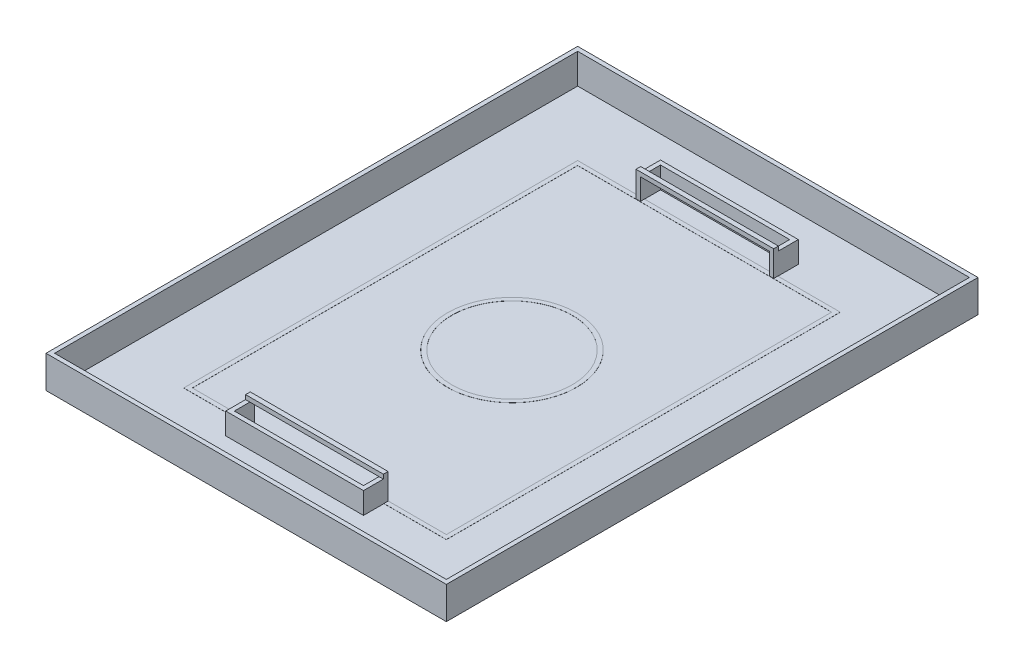
from build123d import *

# Parameters (mm, degrees)
ESBO_O1_W                = 1860
ESBO_O1_H                = 2470
RESSALTO_EXTRUS_O1_DEPTH = 10
ESBO_O2_W                = 1860
ESBO_O2_H                = 2470
ESBO_O2_W_2              = 1820
ESBO_O2_H_2              = 2430
RESSALTO_EXTRUS_O2_DEPTH = 140
ESBO_O3_W                = 1220
ESBO_O3_H                = 1830
ESBO_O3_W_2              = 1180
ESBO_O3_H_2              = 1790
ESBO_O3_R                = 300
ESBO_O3_R_2              = 280
RESSALTO_EXTRUS_O3_DEPTH = 0.5
RESSALTO_EXTRUS_O4_DEPTH = 100
ESBO_O5_W                = 640
ESBO_O5_H                = 21.841865424
RESSALTO_EXTRUS_O5_DEPTH = 20
PADR_OCIRCULAR1_COUNT    = 2


with BuildPart() as part:
    # Esboço1 → Ressalto-extrusão1 (new body)
    with BuildSketch(Plane(origin=(0, 0, 0), x_dir=(1, 0, 0), z_dir=(0, 1, 0))):
        with Locations((930, 1235)):
            Rectangle(ESBO_O1_W, ESBO_O1_H)
    extrude(amount=RESSALTO_EXTRUS_O1_DEPTH)

    # Esboço2 → Ressalto-extrusão2 (add)
    with BuildSketch(Plane(origin=(0, 10, 0), x_dir=(1, 0, 0), z_dir=(0, 1, 0))):
        with Locations((930, 1235)):
            Rectangle(ESBO_O2_W, ESBO_O2_H)
        with Locations((930, 1235)):
            Rectangle(ESBO_O2_W_2, ESBO_O2_H_2, mode=Mode.SUBTRACT)
    extrude(amount=RESSALTO_EXTRUS_O2_DEPTH)

    # Esboço3 → Ressalto-extrusão3 (add)
    # profile 1 of 2: a face of its own
    with BuildSketch(Plane(origin=(0, 10, 0), x_dir=(1, 0, 0), z_dir=(0, 1, 0))):
        with Locations((930, 1235)):
            Rectangle(ESBO_O3_W, ESBO_O3_H)
        with Locations((930, 1235)):
            Rectangle(ESBO_O3_W_2, ESBO_O3_H_2, mode=Mode.SUBTRACT)
    # profile 2 of 2: a face of its own
    with BuildSketch(Plane(origin=(0, 10, 0), x_dir=(1, 0, 0), z_dir=(0, 1, 0))):
        with Locations(Location((930, 1235, 0), (0, 0, 90))):
            Circle(ESBO_O3_R)
        with Locations(Location((930, 1235, 0), (0, 0, 270))):
            Circle(ESBO_O3_R_2, mode=Mode.SUBTRACT)
    extrude(amount=RESSALTO_EXTRUS_O3_DEPTH)

    # Esboço4 → Ressalto-extrusão4 (add)
    with BuildSketch(Plane(origin=(0, 10, 0), x_dir=(1, 0, 0), z_dir=(0, 1, 0))):
        Polygon((630, 2224.941322865), (1230, 2224.941322865), (1230, 2150.941322865), (1230, 2130.941322865), (1250, 2130.941322865), (1250, 2244.941322865), (610, 2244.941322865), (610, 2130.941322865), (630, 2130.941322865), (630, 2150.941322865), align=None)
    ressalto_extrus_o4 = extrude(amount=RESSALTO_EXTRUS_O4_DEPTH)

    # Esboço5 → Ressalto-extrusão5 (add)
    with BuildSketch(Plane(origin=(0, 110, 0), x_dir=(1, 0, 0), z_dir=(0, 1, 0))):
        with Locations((930, 2141.862255577)):
            Rectangle(ESBO_O5_W, ESBO_O5_H)
    ressalto_extrus_o5 = extrude(amount=RESSALTO_EXTRUS_O5_DEPTH)

    # PadrãoCircular1: Ressalto-extrusão4, Ressalto-extrusão5 ×2 about axis
    padr_ocircular1_axis = Axis((930, 10.5, -1235), (0, 1, 0))
    add([ressalto_extrus_o4.rotate(padr_ocircular1_axis, i * 360 / PADR_OCIRCULAR1_COUNT) for i in range(1, PADR_OCIRCULAR1_COUNT)])
    add([ressalto_extrus_o5.rotate(padr_ocircular1_axis, i * 360 / PADR_OCIRCULAR1_COUNT) for i in range(1, PADR_OCIRCULAR1_COUNT)])


solid = part.part
